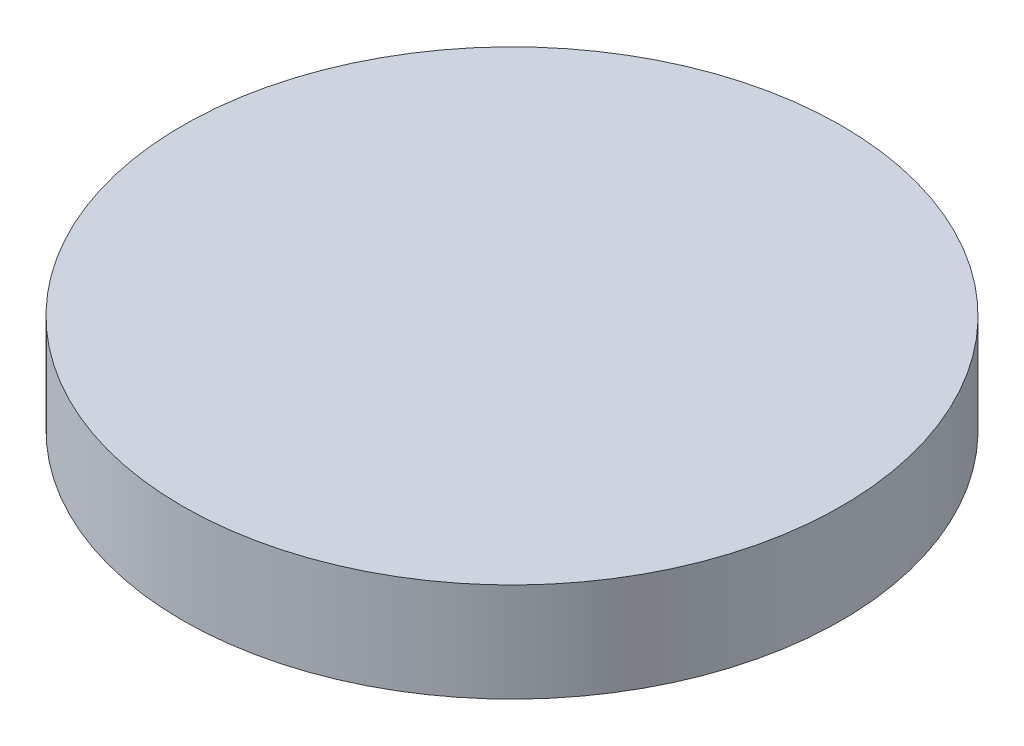
from build123d import *

# Parameters (mm, degrees)
SKETCH_1_R      = 5
EXTRUDE_1_DEPTH = 1.5


with BuildPart() as part:
    # 草图1 → 凸台-拉伸1 (new body)
    with BuildSketch(Plane(origin=(0, 0, 0), x_dir=(1, 0, 0), z_dir=(0, 1, 0))):
        with Locations(Location((0, 0, 0), (0, 0, 270))):
            Circle(SKETCH_1_R)
    extrude(amount=EXTRUDE_1_DEPTH)


solid = part.part
